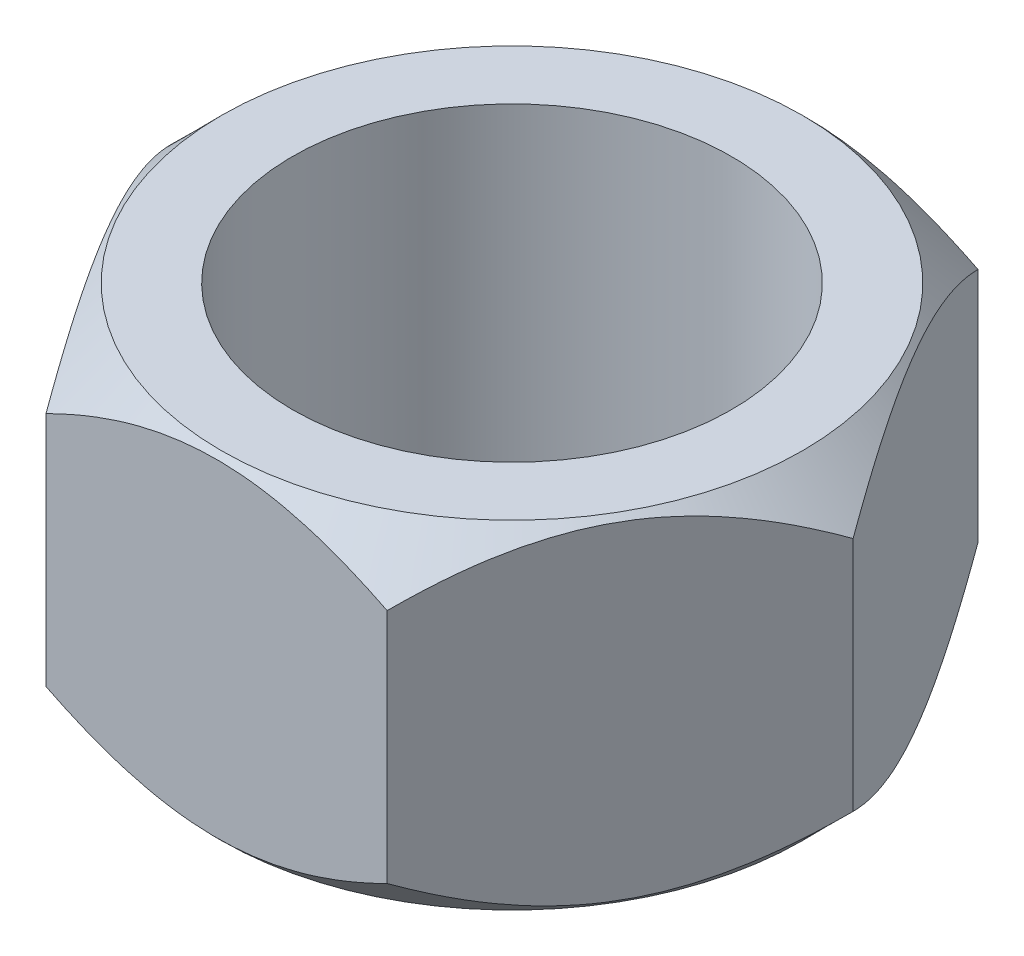
from build123d import *

# Parameters (mm, degrees)
SKETCH1_R           = 0.13
BOSS_EXTRUDE1_DEPTH = 0.2


with BuildPart() as part:
    # Sketch1 → Boss-Extrude1 (new body)
    with BuildSketch(Plane(origin=(0, 0, 0), x_dir=(1, 0, 0), z_dir=(0, 1, 0))):
        Polygon((0.101036297, 0.175), (-0.101036297, 0.175), (-0.202072594, 0), (-0.101036297, -0.175), (0.101036297, -0.175), (0.202072594, 0), align=None)
        with Locations(Location((0, 0, 0), (0, 0, 270))):
            Circle(SKETCH1_R, mode=Mode.SUBTRACT)
    extrude(amount=BOSS_EXTRUDE1_DEPTH)

    # Sketch3 → Cut-Revolve5 (revolve, cut)
    with BuildSketch(Plane.XY, mode=Mode.PRIVATE) as cut_revolve5_sk:
        Polygon((0.172072594, 0.2), (0.202072594, 0.2), (0.202072594, 0.17), align=None)
        Polygon((0.202072594, 0), (0.202072594, 0.03), (0.172072594, 0), align=None)
    revolve(cut_revolve5_sk.sketch.rotate(Axis((0, 0.2, 0), (0, -1, 0)), 180), axis=Axis((0, 0.2, 0), (0, -1, 0)), mode=Mode.SUBTRACT)


solid = part.part
